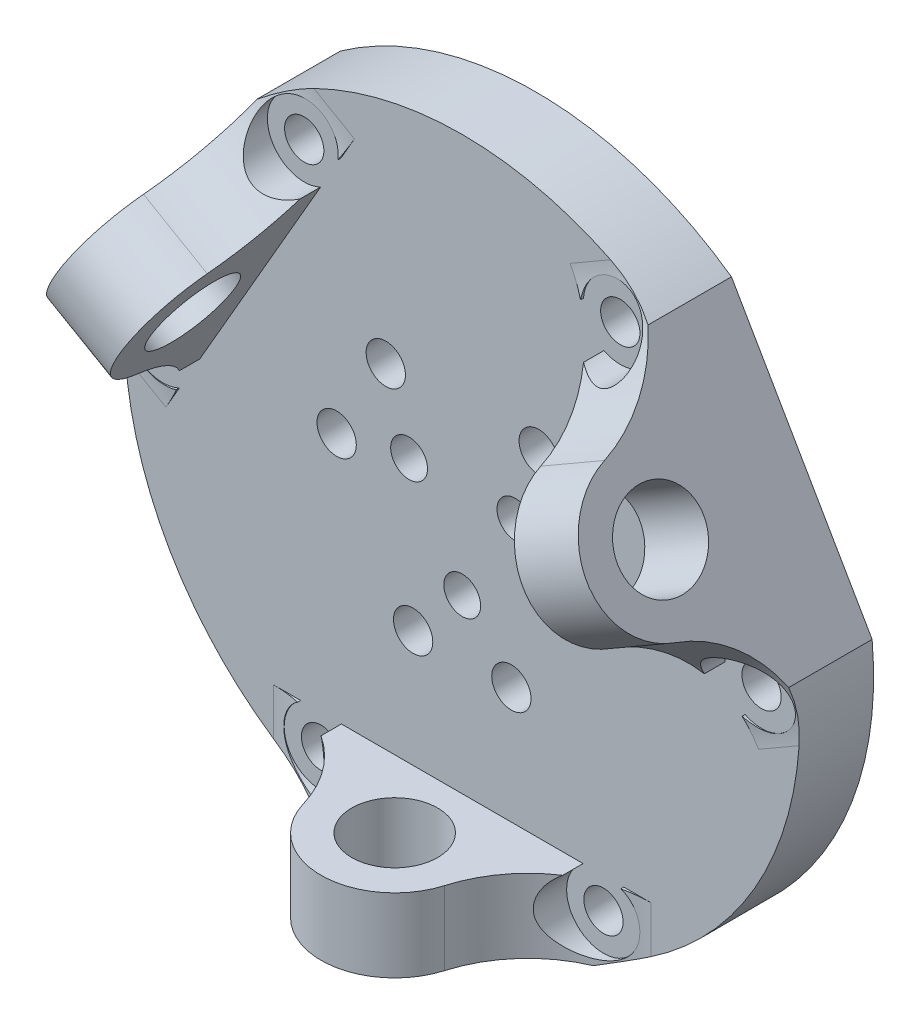
from build123d import *

# Parameters (mm, degrees)
SKETCH_1_R               = 27.5
EXTRUDE_1_DEPTH          = 6
SKETCH_2_R               = 6
SKETCH_2_R_2             = 3.499999999999999
EXTRUDE_2_DEPTH          = 6
PATTERN_CIRCULAR_3_COUNT = 3
CUT_EXTRUDE_1_DEPTH      = 61.37176492367935
FILLET_1_R               = 10
SKETCH_6_R               = 1.6000000000000016
SKETCH_6_R_2             = 1.6
CUT_EXTRUDE_2_DEPTH      = 62.79603560803595
SKETCH_7_R               = 2.999999999999999
CUT_EXTRUDE_3_DEPTH      = 61.37176506339406
PATTERN_CIRCULAR_4_COUNT = 3
SKETCH_8_R               = 1.5000000000000009
SKETCH_8_R_2             = 1.5000000000000018
SKETCH_8_R_3             = 1.5
CUT_EXTRUDE_4_DEPTH      = 61.37176506339406
FILLET_2_R               = 1


with BuildPart() as part:
    # 草图1 → 凸台-拉伸1 (new body)
    with BuildSketch(Plane.XY):
        with Locations((0, 25)):
            Circle(SKETCH_1_R)
    extrude(amount=EXTRUDE_1_DEPTH)

    # 草图2 → 凸台-拉伸2 (add)
    with BuildSketch(Plane(origin=(0, 0, 0), x_dir=(1, 0, 0), z_dir=(0, 1, 0))):
        with Locations((0, -11.5)):
            Circle(SKETCH_2_R)
        with Locations(Location((0, -11.5, 0), (0, 0, 270))):
            Circle(SKETCH_2_R_2, mode=Mode.SUBTRACT)
    extrude_2 = extrude(amount=EXTRUDE_2_DEPTH)

    # 阵列(圆周)3: 凸台-拉伸2 ×3 about axis
    pattern_circular_3_axis = Axis((8.33e-15, 25.000000000000004, 0), (0, 0, 1))
    for i in range(1, PATTERN_CIRCULAR_3_COUNT):
        add(extrude_2.rotate(pattern_circular_3_axis, i * 360 / PATTERN_CIRCULAR_3_COUNT))

    # 草图5 → 切除-拉伸1 (cut, through all)
    with BuildSketch(Plane.XY.offset(6)):
        with BuildLine():
            Line((-20.45167721378295, 39.57665596572934), (-15.92241547591627, 47.42156741649214))
            ThreePointArc((-15.922415475916265, 47.421567416492145), (-23.815698604072065, 38.75), (-27.378854713305756, 27.578432583507904))
            Line((-27.378854713305753, 27.578432583507908), (-22.8495929754393, 35.423344034270315))
            Line((-22.849592975439244, 35.42334403427027), (-20.451677213782926, 39.57665596572932))
        make_face()
        with BuildLine():
            Line((-2.3979157616563604, 0), (-11.456439237389594, 0))
            ThreePointArc((-11.456439237389615, 7.11e-15), (-5.05e-15, -2.5), (11.456439237389606, 3.55e-15))
            Line((11.456439237389601, 0), (2.3979157616563604, 0))
            Line((2.397915761656361, 0), (-2.397915761656361, 0))
        make_face()
        with BuildLine():
            ThreePointArc((27.378854713305756, 27.578432583507883), (23.815698604072058, 38.75000000000001), (15.922415475916232, 47.42156741649217))
            Line((15.922415475916235, 47.421567416492174), (20.451677213782762, 39.576655965729636))
            Line((20.451677213782723, 39.576655965729614), (22.8495929754391, 35.42334403427059))
            Line((22.849592975439123, 35.423344034270606), (27.378854713305756, 27.578432583507883))
        make_face()
    extrude(amount=-CUT_EXTRUDE_1_DEPTH, mode=Mode.SUBTRACT)

    # 圆角1
    fillet_1_edges = [part.edges().sort_by_distance(p)[0] for p in [
        (-17.853601002429457, 38.076655965729536, 6),
        (-20.25151676408582, 33.92334403427051, 6),
        (20.251516764085842, 33.92334403427047, 6),
        (17.853601002429485, 38.076655965729515, 6),
        (-2.3979157616563596, 3, 6),
        (2.3979157616563596, 3, 6),
    ]]
    fillet(fillet_1_edges, radius=FILLET_1_R)

    # 草图6 → 切除-拉伸2 (cut, through all)
    with BuildSketch(Plane(origin=(0, 0, 0), x_dir=(-1, 0, 0), z_dir=(0, 0, -1))):
        with Locations((-11.5, 3.5)):
            Circle(SKETCH_6_R)
        with Locations((11.5, 3.5)):
            Circle(SKETCH_6_R)
        with Locations((-4.000000000000002, 15.5)):
            Circle(SKETCH_6_R_2)
        with Locations((3.9999999999999982, 15.5)):
            Circle(SKETCH_6_R_2)
    cut_extrude_2 = extrude(amount=-CUT_EXTRUDE_2_DEPTH, mode=Mode.SUBTRACT)

    # 草图7 → 切除-拉伸3 (cut, through all)
    with BuildSketch(Plane.XY.offset(6)):
        with Locations((-11.5, 3.5)):
            Circle(SKETCH_7_R)
        with Locations((11.5, 3.5)):
            Circle(SKETCH_7_R)
    cut_extrude_3 = extrude(amount=CUT_EXTRUDE_3_DEPTH, mode=Mode.SUBTRACT)

    # 阵列(圆周)4: 切除-拉伸2, 切除-拉伸3 ×3 about axis
    pattern_circular_4_axis = Axis((0, 25.00000000000001, 0), (0, 0, 1))
    add([cut_extrude_2.rotate(pattern_circular_4_axis, i * 360 / PATTERN_CIRCULAR_4_COUNT) for i in range(1, PATTERN_CIRCULAR_4_COUNT)], mode=Mode.SUBTRACT)
    add([cut_extrude_3.rotate(pattern_circular_4_axis, i * 360 / PATTERN_CIRCULAR_4_COUNT) for i in range(1, PATTERN_CIRCULAR_4_COUNT)], mode=Mode.SUBTRACT)

    # 草图8 → 切除-拉伸4 (cut, through all)
    with BuildSketch(Plane.XY.offset(6)):
        with Locations((0, 20)):
            Circle(SKETCH_8_R)
        with Locations((-4.330127018922196, 27.500000000000004)):
            Circle(SKETCH_8_R_2)
        with Locations((4.330127018922196, 27.5)):
            Circle(SKETCH_8_R_3)
    extrude(amount=-CUT_EXTRUDE_4_DEPTH, mode=Mode.SUBTRACT)

    # 圆角2
    fillet_2_edges = [part.edges().sort_by_distance(p)[0] for p in [
        (-1.5000000000000009, 20, 0),
        (-5.830127018922198, 27.500000000000004, 0),
        (2.8301270189221963, 27.5, 0),
    ]]
    fillet(fillet_2_edges, radius=FILLET_2_R)


solid = part.part
